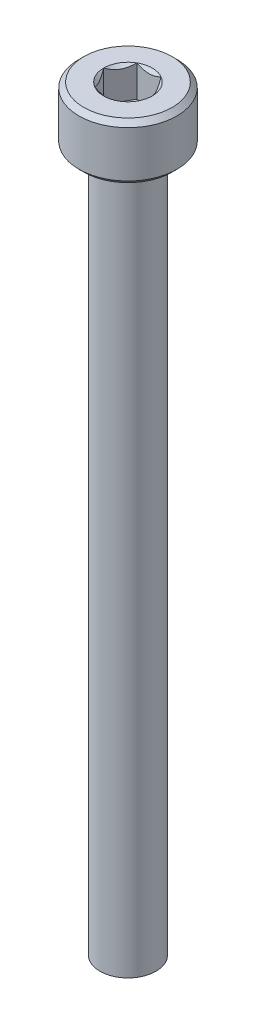
from build123d import *

# Parameters (mm, degrees)
SKETCH1_R           = 3.5
BOSS_EXTRUDE1_DEPTH = 4
CUT_EXTRUDE1_DEPTH  = 2.25
CHAMFER1_SIZE       = 0.35
SKETCH_1_R          = 2
EXTRUDE_1_DEPTH     = 50


with BuildPart() as part:
    # Sketch1 → Boss-Extrude1 (new body)
    with BuildSketch(Plane(origin=(0, 0, 0), x_dir=(1, 0, 0), z_dir=(0, 1, 0))):
        with Locations(Location((0, 0, 0), (0, 0, 270))):
            Circle(SKETCH1_R)
    extrude(amount=BOSS_EXTRUDE1_DEPTH)

    # Sketch2 → Cut-Extrude1 (cut)
    with BuildSketch(Plane(origin=(0, 4, 0), x_dir=(1, 0, 0), z_dir=(0, 1, 0))):
        Polygon((0.866025404, 1.5), (-0.866025404, 1.5), (-1.732050808, 0), (-0.866025404, -1.5), (0.866025404, -1.5), (1.732050808, 0), align=None)
    extrude(amount=-CUT_EXTRUDE1_DEPTH, mode=Mode.SUBTRACT)

    # Cut-Extrude2 cone 1 section (through the dimple's axis) → Cut-Extrude2 (revolve, cut)
    with BuildSketch(Plane(origin=(0, 4, 0), x_dir=(0, 0, 1), z_dir=(1, 0, 0))):
        Polygon((0, 0), (1.732050808, 0), (0, 1.732050808), align=None)
    revolve(axis=Axis((0, 4, 0), (0, -1, 0)), mode=Mode.SUBTRACT)

    # Chamfer1
    chamfer1_edges = [part.edges().sort_by_distance(p)[0] for p in [
        (0, 0, -3.5),
        (0, 4, -3.5),
    ]]
    chamfer(chamfer1_edges, length=CHAMFER1_SIZE)

    # 草图1 → 凸台-拉伸1 (add)
    with BuildSketch(Plane(origin=(0, 0, 0), x_dir=(-1, 0, 0), z_dir=(0, -1, 0))):
        with Locations(Location((0, 0, 0), (0, 0, 90))):
            Circle(SKETCH_1_R)
    extrude(amount=EXTRUDE_1_DEPTH)


solid = part.part
